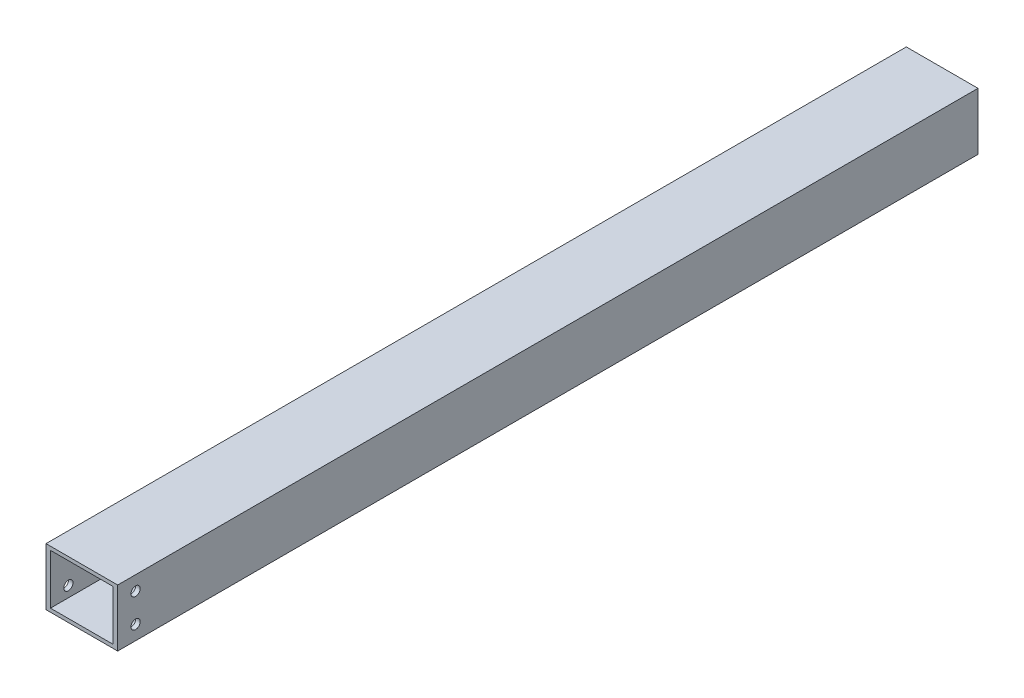
from build123d import *

# Parameters (mm, degrees)
SKETCH1_W           = 25.4
SKETCH1_H           = 20.275670742
SKETCH1_W_2         = 22.225
SKETCH1_H_2         = 17.7412119
BOSS_EXTRUDE2_DEPTH = 304.8
SKETCH2_R           = 1.63195
CUT_EXTRUDE1_DEPTH  = 307.02446913


with BuildPart() as part:
    # Sketch1 → Boss-Extrude2 (new body)
    with BuildSketch(Plane.XY):
        Rectangle(SKETCH1_W, SKETCH1_H)
        Rectangle(SKETCH1_W_2, SKETCH1_H_2, mode=Mode.SUBTRACT)
    extrude(amount=BOSS_EXTRUDE2_DEPTH)

    # Sketch2 → Cut-Extrude1 (cut, through all)
    with BuildSketch(Plane(origin=(12.7, 0, 0), x_dir=(0, 0, -1), z_dir=(1, 0, 0))):
        with Locations((-298.45, -5.08)):
            Circle(SKETCH2_R)
        with Locations((-298.45, 5.08)):
            Circle(SKETCH2_R)
    extrude(amount=-CUT_EXTRUDE1_DEPTH, mode=Mode.SUBTRACT)


solid = part.part
